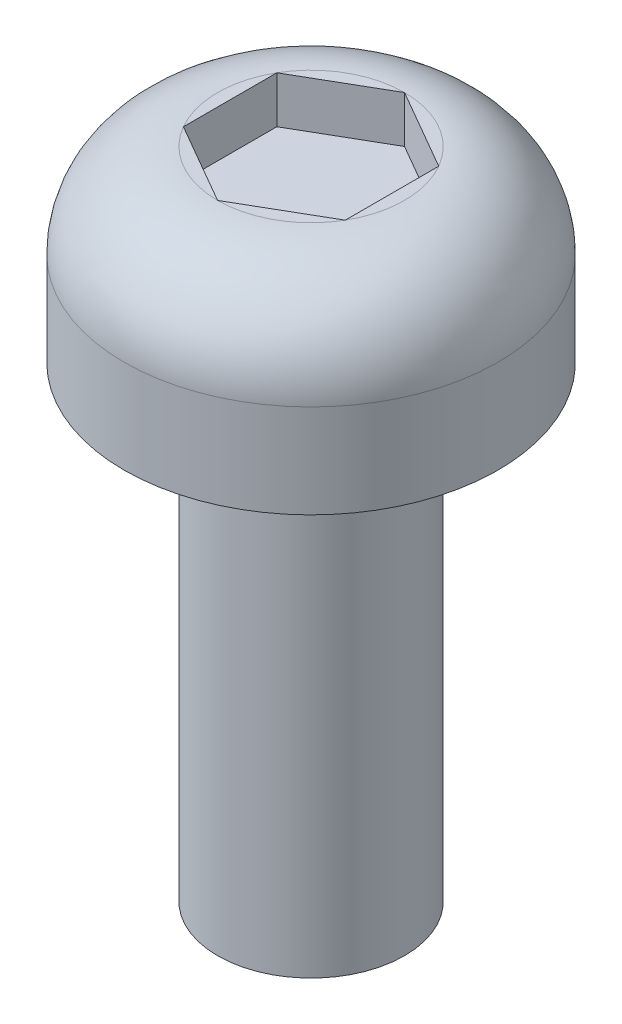
from build123d import *

# Parameters (mm, degrees)
SKETCH1_R           = 1
BOSS_EXTRUDE1_DEPTH = 5
SKETCH2_R           = 2
BOSS_EXTRUDE2_DEPTH = 2
FILLET1_R           = 1
CUT_EXTRUDE1_DEPTH  = 0.5


with BuildPart() as part:
    # Sketch1 → Boss-Extrude1 (new body)
    with BuildSketch(Plane(origin=(0, 0, 0), x_dir=(1, 0, 0), z_dir=(0, 1, 0))):
        with Locations(Location((0, 0, 0), (0, 0, 270))):
            Circle(SKETCH1_R)
    extrude(amount=BOSS_EXTRUDE1_DEPTH)

    # Sketch2 → Boss-Extrude2 (add)
    with BuildSketch(Plane(origin=(0, 5, 0), x_dir=(1, 0, 0), z_dir=(0, 1, 0))):
        with Locations(Location((0, 0, 0), (0, 0, 270))):
            Circle(SKETCH2_R)
    extrude(amount=BOSS_EXTRUDE2_DEPTH)

    # Fillet1
    fillet1_edges = [part.edges().sort_by_distance(p)[0] for p in [
        (0, 7, -2),
    ]]
    fillet(fillet1_edges, radius=FILLET1_R)

    # Sketch3 → Cut-Extrude1 (cut)
    with BuildSketch(Plane(origin=(0, 7, 0), x_dir=(1, 0, 0), z_dir=(0, 1, 0))):
        Polygon((-0.866025404, 0.5), (0, 0), (0, 1), align=None)
        Polygon((-0.866025404, -0.5), (0, 0), (-0.866025404, 0.5), align=None)
        Polygon((-0.866025404, -0.5), (0, -1), (0, 0), align=None)
        Polygon((0, 0), (0, -1), (0.866025404, -0.5), align=None)
        Polygon((0.866025404, 0.5), (0, 0), (0.866025404, -0.5), align=None)
        Polygon((0, 1), (0, 0), (0.866025404, 0.5), align=None)
    extrude(amount=-CUT_EXTRUDE1_DEPTH, mode=Mode.SUBTRACT)


solid = part.part
